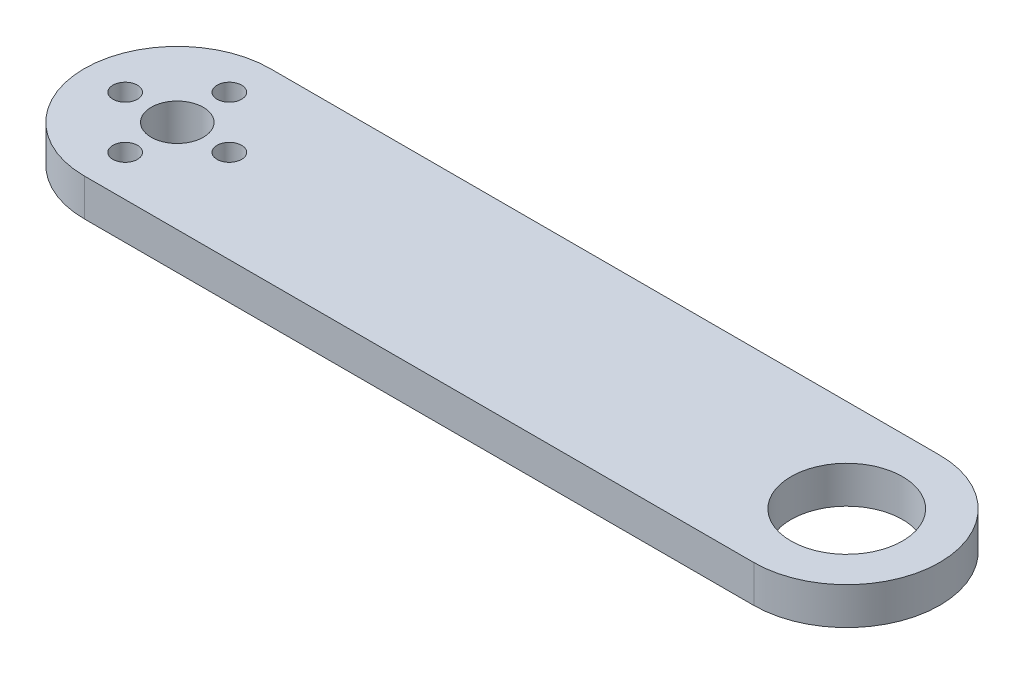
from build123d import *

# Parameters (mm, degrees)
EXTRUDE_1_DEPTH     = 5
CUT_EXTRUDE_1_REACH = 61.055
SKETCH_2_R          = 3.5
SKETCH_2_R_2        = 7.5
SKETCH_2_R_3        = 1.65


with BuildPart() as part:
    # 草图1 → 凸台-拉伸1 (new body)
    with BuildSketch(Plane(origin=(0, 0, 0), x_dir=(1, 0, 0), z_dir=(0, 1, 0))):
        with BuildLine():
            Line((45, -12.5), (-45, -12.5))
            ThreePointArc((-45, -12.5), (-57.5, 0), (-45, 12.5))
            Line((-45, 12.5), (45, 12.5))
            ThreePointArc((45, 12.5), (57.5, 0), (45, -12.5))
        make_face()
    extrude(amount=EXTRUDE_1_DEPTH)

    # 草图2 → 切除-拉伸1 (cut, up to next)
    with BuildSketch(Plane(origin=(0, 5, 0), x_dir=(1, 0, 0), z_dir=(0, 1, 0)), mode=Mode.PRIVATE) as cut_extrude_1_sk1:
        with Locations(Location((-45, 0, 0), (0, 0, 270))):
            Circle(SKETCH_2_R)
    cut_extrude_1_tool1 = extrude(cut_extrude_1_sk1.sketch, amount=-CUT_EXTRUDE_1_REACH, mode=Mode.PRIVATE) & part.part
    # 草图2 → 切除-拉伸1 (cut, up to next)
    with BuildSketch(Plane(origin=(0, 5, 0), x_dir=(1, 0, 0), z_dir=(0, 1, 0)), mode=Mode.PRIVATE) as cut_extrude_1_sk2:
        with Locations(Location((45, 0, 0), (0, 0, 270))):
            Circle(SKETCH_2_R_2)
    cut_extrude_1_tool2 = extrude(cut_extrude_1_sk2.sketch, amount=-CUT_EXTRUDE_1_REACH, mode=Mode.PRIVATE) & part.part
    # 草图2 → 切除-拉伸1 (cut, up to next)
    with BuildSketch(Plane(origin=(0, 5, 0), x_dir=(1, 0, 0), z_dir=(0, 1, 0)), mode=Mode.PRIVATE) as cut_extrude_1_sk3:
        with Locations(Location((-45, 7, 0), (0, 0, 270))):
            Circle(SKETCH_2_R_3)
    cut_extrude_1_tool3 = extrude(cut_extrude_1_sk3.sketch, amount=-CUT_EXTRUDE_1_REACH, mode=Mode.PRIVATE) & part.part
    # 草图2 → 切除-拉伸1 (cut, up to next)
    with BuildSketch(Plane(origin=(0, 5, 0), x_dir=(1, 0, 0), z_dir=(0, 1, 0)), mode=Mode.PRIVATE) as cut_extrude_1_sk4:
        with Locations(Location((-38, 0, 0), (0, 0, 270))):
            Circle(SKETCH_2_R_3)
    cut_extrude_1_tool4 = extrude(cut_extrude_1_sk4.sketch, amount=-CUT_EXTRUDE_1_REACH, mode=Mode.PRIVATE) & part.part
    # 草图2 → 切除-拉伸1 (cut, up to next)
    with BuildSketch(Plane(origin=(0, 5, 0), x_dir=(1, 0, 0), z_dir=(0, 1, 0)), mode=Mode.PRIVATE) as cut_extrude_1_sk5:
        with Locations(Location((-45, -7, 0), (0, 0, 270))):
            Circle(SKETCH_2_R_3)
    cut_extrude_1_tool5 = extrude(cut_extrude_1_sk5.sketch, amount=-CUT_EXTRUDE_1_REACH, mode=Mode.PRIVATE) & part.part
    # 草图2 → 切除-拉伸1 (cut, up to next)
    with BuildSketch(Plane(origin=(0, 5, 0), x_dir=(1, 0, 0), z_dir=(0, 1, 0)), mode=Mode.PRIVATE) as cut_extrude_1_sk6:
        with Locations(Location((-52, 0, 0), (0, 0, 270))):
            Circle(SKETCH_2_R_3)
    cut_extrude_1_tool6 = extrude(cut_extrude_1_sk6.sketch, amount=-CUT_EXTRUDE_1_REACH, mode=Mode.PRIVATE) & part.part
    add(cut_extrude_1_tool1.solids().sort_by_distance((-45, 5, 0))[0], mode=Mode.SUBTRACT)
    add(cut_extrude_1_tool2.solids().sort_by_distance((45, 5, 0))[0], mode=Mode.SUBTRACT)
    add(cut_extrude_1_tool3.solids().sort_by_distance((-45, 5, -7))[0], mode=Mode.SUBTRACT)
    add(cut_extrude_1_tool4.solids().sort_by_distance((-38, 5, 0))[0], mode=Mode.SUBTRACT)
    add(cut_extrude_1_tool5.solids().sort_by_distance((-45, 5, 7))[0], mode=Mode.SUBTRACT)
    add(cut_extrude_1_tool6.solids().sort_by_distance((-52, 5, 0))[0], mode=Mode.SUBTRACT)


solid = part.part
